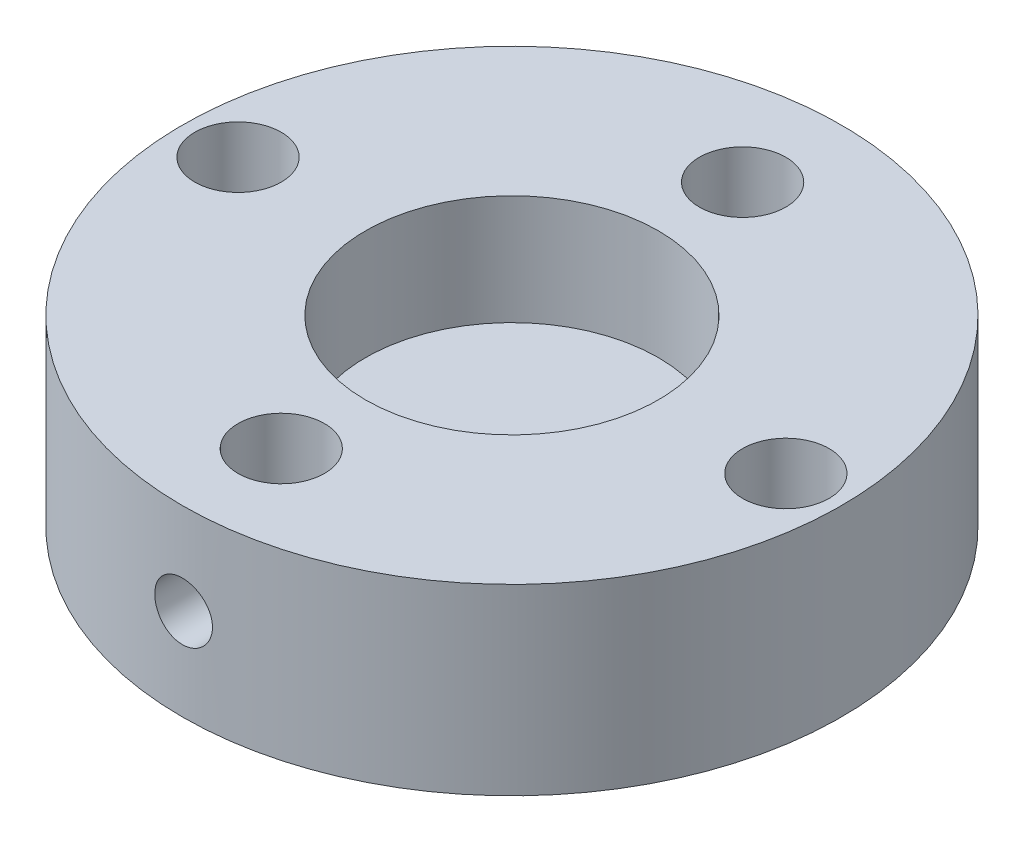
from build123d import *

# Parameters (mm, degrees)
SKETCH2_R               = 11.43
BOSS_EXTRUDE1_DEPTH     = 6.35
SKETCH4_R               = 1.5
CUT_EXTRUDE1_DEPTH      = 18.366988801
CUT_EXTRUDE2_REACH      = 29.445
CUT_EXTRUDE2_END_RADIUS = 1.5
CUT_EXTRUDE3_REACH      = 29.445
CUT_EXTRUDE3_END_RADIUS = 1.5
SKETCH9_R               = 1
SKETCH10_R              = 5.08
CUT_EXTRUDE4_DEPTH      = 3.81


with BuildPart() as part:
    # Sketch2 → Boss-Extrude1 (new body)
    with BuildSketch(Plane(origin=(0, 0, 0), x_dir=(1, 0, 0), z_dir=(0, 1, 0))):
        with Locations(Location((0, 0, 0), (0, 0, 270))):
            Circle(SKETCH2_R)
    extrude(amount=BOSS_EXTRUDE1_DEPTH)

    # Sketch4 → Cut-Extrude1 (cut, through all)
    with BuildSketch(Plane(origin=(0, 6.35, 0), x_dir=(1, 0, 0), z_dir=(0, 1, 0))):
        with Locations(Location((0, 8, 0), (0, 0, 270))):
            Circle(SKETCH4_R)
        with Locations(Location((0, -8, 0), (0, 0, 270))):
            Circle(SKETCH4_R)
        with Locations(Location((9.5, 0, 0), (0, 0, 270))):
            Circle(SKETCH4_R)
        with Locations(Location((-9.5, 0, 0), (0, 0, 270))):
            Circle(SKETCH4_R)
    extrude(amount=-CUT_EXTRUDE1_DEPTH, mode=Mode.SUBTRACT)

    # Cut-Extrude2: up to this cylinder (the profile starts outside it)
    cut_extrude2_end = Plane(origin=(0, 3.175, 8), z_dir=(0, 1, 0)) * Cylinder(CUT_EXTRUDE2_END_RADIUS, 62.89, mode=Mode.PRIVATE)
    # Sketch8 → Cut-Extrude2 (cut, up to the surface)
    with BuildSketch(Plane.XY.offset(12.7), mode=Mode.PRIVATE) as cut_extrude2_sk1:
        with BuildLine():
            ThreePointArc((1, 3.175), (0.707106781, 3.882106781), (0, 4.175))
            Line((0, 4.175), (0, 2.175))
            ThreePointArc((0, 2.175), (0.707106781, 2.467893219), (1, 3.175))
        make_face()
    cut_extrude2_tool1 = extrude(cut_extrude2_sk1.sketch, amount=-CUT_EXTRUDE2_REACH, mode=Mode.PRIVATE) - cut_extrude2_end
    add(cut_extrude2_tool1.solids().sort_by_distance((0.424413, 3.175, 12.7))[0], mode=Mode.SUBTRACT)
    # Sketch8 → Cut-Extrude2 (cut, up to the surface)
    with BuildSketch(Plane.XY.offset(12.7), mode=Mode.PRIVATE) as cut_extrude2_sk2:
        with BuildLine():
            Line((0, 2.175), (0, 4.175))
            ThreePointArc((0, 4.175), (-1, 3.175), (0, 2.175))
        make_face()
    cut_extrude2_tool2 = extrude(cut_extrude2_sk2.sketch, amount=-CUT_EXTRUDE2_REACH, mode=Mode.PRIVATE) - cut_extrude2_end
    add(cut_extrude2_tool2.solids().sort_by_distance((-0.424413, 3.175, 12.7))[0], mode=Mode.SUBTRACT)
    # Sketch8 → Cut-Extrude2 (cut, up to the surface)
    with BuildSketch(Plane.XY.offset(12.7), mode=Mode.PRIVATE) as cut_extrude2_sk3:
        with BuildLine():
            ThreePointArc((1, 3.175), (0.707106781, 3.882106781), (0, 4.175))
            Line((0, 4.175), (0, 2.175))
            ThreePointArc((0, 2.175), (0.707106781, 2.467893219), (1, 3.175))
        make_face()
    cut_extrude2_tool3 = extrude(cut_extrude2_sk3.sketch, amount=-CUT_EXTRUDE2_REACH, mode=Mode.PRIVATE) - cut_extrude2_end
    add(cut_extrude2_tool3.solids().sort_by_distance((0.424413, 3.175, 12.7))[0], mode=Mode.SUBTRACT)
    # Sketch8 → Cut-Extrude2 (cut, up to the surface)
    with BuildSketch(Plane.XY.offset(12.7), mode=Mode.PRIVATE) as cut_extrude2_sk4:
        with BuildLine():
            Line((0, 2.175), (0, 4.175))
            ThreePointArc((0, 4.175), (-1, 3.175), (0, 2.175))
        make_face()
    cut_extrude2_tool4 = extrude(cut_extrude2_sk4.sketch, amount=-CUT_EXTRUDE2_REACH, mode=Mode.PRIVATE) - cut_extrude2_end
    add(cut_extrude2_tool4.solids().sort_by_distance((-0.424413, 3.175, 12.7))[0], mode=Mode.SUBTRACT)

    # Cut-Extrude3: up to this cylinder (the profile starts outside it)
    cut_extrude3_end = Plane(origin=(0, 3.175, -8), z_dir=(0, 1, 0)) * Cylinder(CUT_EXTRUDE3_END_RADIUS, 62.89, mode=Mode.PRIVATE)
    # Sketch9 → Cut-Extrude3 (cut, up to the surface)
    with BuildSketch(Plane.XY.offset(-12.7), mode=Mode.PRIVATE) as cut_extrude3_sk1:
        with Locations(Location((0, 3.175, 0), (0, 0, 270))):
            Circle(SKETCH9_R)
    cut_extrude3_tool1 = extrude(cut_extrude3_sk1.sketch, amount=CUT_EXTRUDE3_REACH, mode=Mode.PRIVATE) - cut_extrude3_end
    add(cut_extrude3_tool1.solids().sort_by_distance((0, 3.175, -12.7))[0], mode=Mode.SUBTRACT)

    # Sketch10 → Cut-Extrude4 (cut)
    with BuildSketch(Plane(origin=(0, 6.35, 0), x_dir=(1, 0, 0), z_dir=(0, 1, 0))):
        with Locations(Location((0, 0, 0), (0, 0, 270))):
            Circle(SKETCH10_R)
    extrude(amount=-CUT_EXTRUDE4_DEPTH, mode=Mode.SUBTRACT)


solid = part.part
